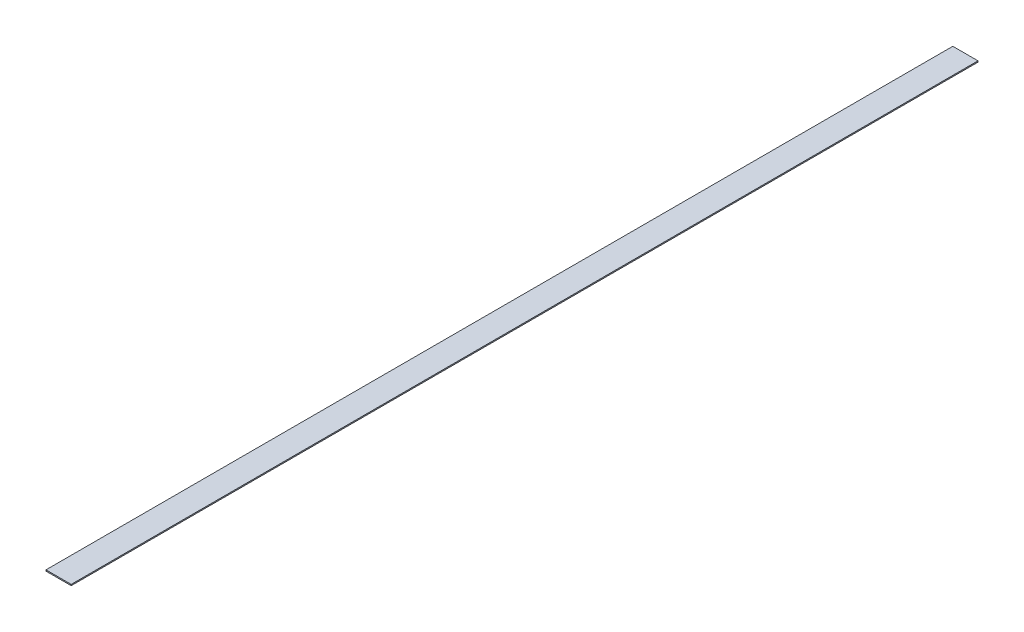
from build123d import *

# Parameters (mm, degrees)
BOSS_EXTRUDE1_DEPTH      = 914.4
BOSS_EXTRUDE1_DEPTH_BACK = 914.4
SKETCH3_W                = 50.8
SKETCH3_H                = 2.38125


with BuildPart() as part:
    # Sketch3 → Boss-Extrude1 (new, two sides: drawn at the far end of the back side and taken through both)
    with BuildSketch(Plane.XY.offset(-BOSS_EXTRUDE1_DEPTH_BACK)):
        Rectangle(SKETCH3_W, SKETCH3_H)
    extrude(amount=BOSS_EXTRUDE1_DEPTH + BOSS_EXTRUDE1_DEPTH_BACK)


solid = part.part
